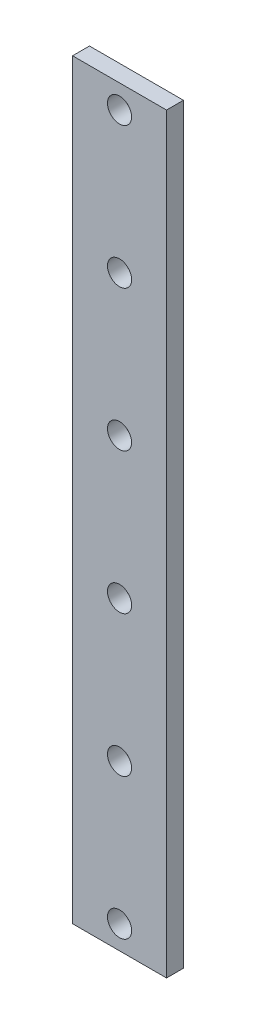
from build123d import *

# Parameters (mm, degrees)
SKETCH1_W             = 12.7
SKETCH1_H             = 101.6
BOSS_EXTRUDE2_DEPTH   = 1.143
F_4_CLEARANCE_HOLE1_D = 3.2639


with BuildPart() as part:
    # Sketch1 → Boss-Extrude2 (new, symmetric)
    with BuildSketch(Plane.XY):
        Rectangle(SKETCH1_W, SKETCH1_H)
    extrude(amount=BOSS_EXTRUDE2_DEPTH, both=True)

    # #4 Clearance Hole1 (through all)
    with Locations(Plane.XY.offset(1.143)):
        with Locations((0, 47.625), (0, 28.575), (0, 9.525), (0, -9.525), (0, -28.575), (0, -47.625)):
            Hole(F_4_CLEARANCE_HOLE1_D / 2)


solid = part.part
